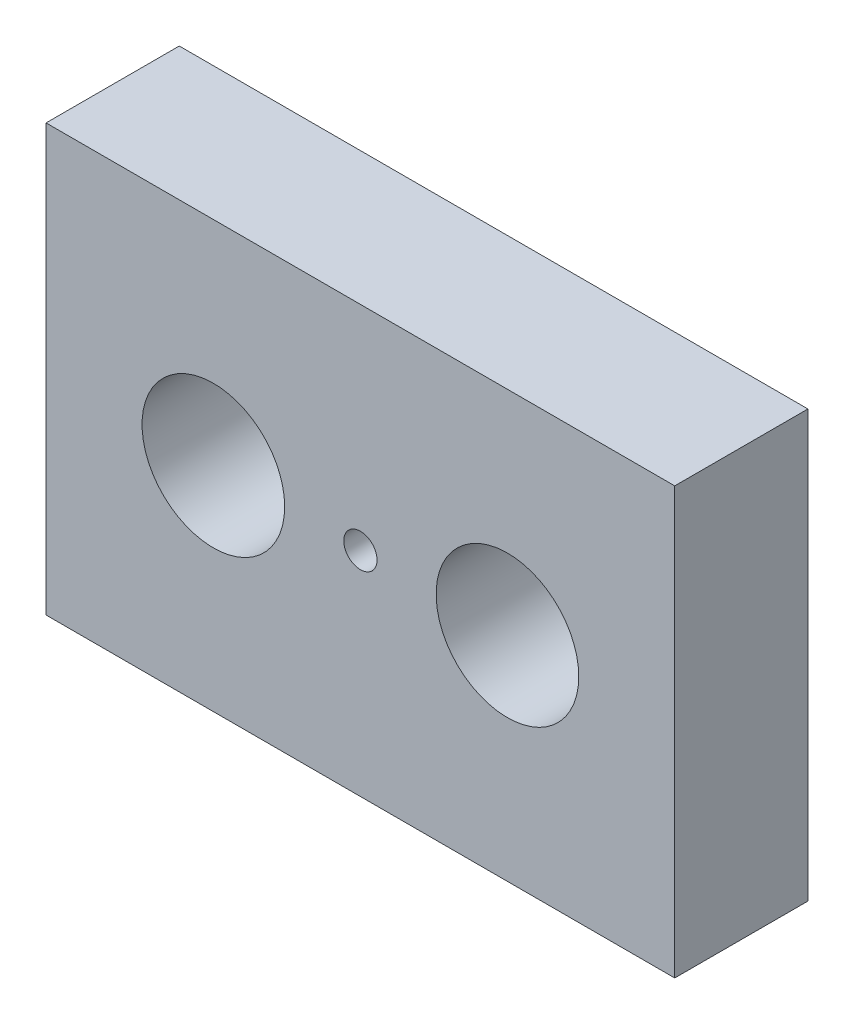
from build123d import *

# Parameters (mm, degrees)
SKETCH1_W                = 14.986
SKETCH1_H                = 10.16
BOSS_EXTRUDE1_DEPTH      = 3.175
M3_CLEARANCE_HOLE1_D     = 3.4
M3_CLEARANCE_HOLE1_DEPTH = 10
M3_CLEARANCE_HOLE1_TIP   = 1.021463052
SKETCH4_R                = 0.396875
CUT_EXTRUDE1_DEPTH       = 19.38168711


with BuildPart() as part:
    # Sketch1 → Boss-Extrude1 (new body)
    with BuildSketch(Plane.XY):
        with Locations((7.493, 5.08)):
            Rectangle(SKETCH1_W, SKETCH1_H)
    extrude(amount=BOSS_EXTRUDE1_DEPTH)

    # M3 Clearance Hole1
    with Locations(Plane.XY.offset(3.175)):
        with Locations((10.9982, 5.08), (3.9878, 5.08)):
            Hole(M3_CLEARANCE_HOLE1_D / 2, depth=M3_CLEARANCE_HOLE1_DEPTH)
            with Locations((0, 0, -(M3_CLEARANCE_HOLE1_DEPTH + M3_CLEARANCE_HOLE1_TIP / 2))):  # 118° drill point
                Cone(0, M3_CLEARANCE_HOLE1_D / 2, M3_CLEARANCE_HOLE1_TIP, mode=Mode.SUBTRACT)

    # Sketch4 → Cut-Extrude1 (cut, through all)
    with BuildSketch(Plane.XY.offset(3.175)):
        with Locations((7.493, 5.08)):
            Circle(SKETCH4_R)
    extrude(amount=-CUT_EXTRUDE1_DEPTH, mode=Mode.SUBTRACT)


solid = part.part
